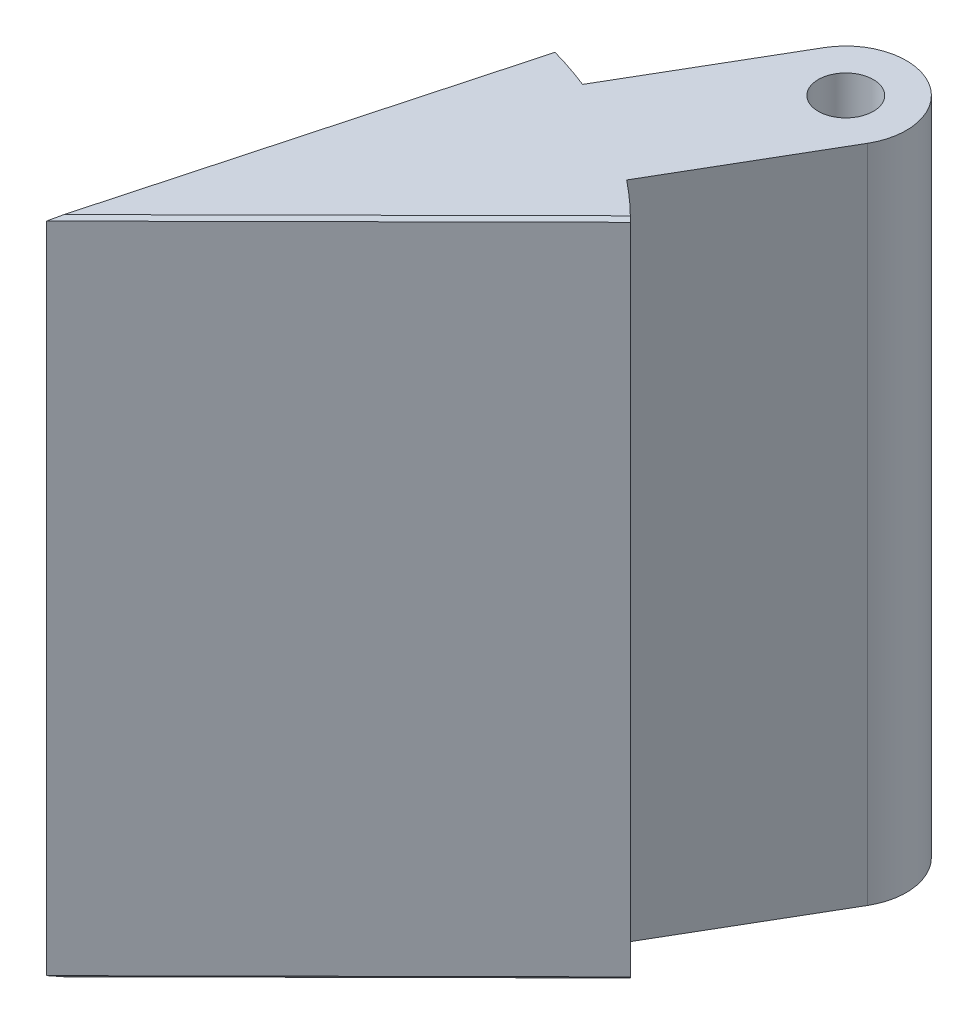
from build123d import *

# Parameters (mm, degrees)
SKETCH1_R           = 0.835
BOSS_EXTRUDE1_DEPTH = 20
CHAMFER1_SIZE       = 0.1


with BuildPart() as part:
    # Sketch1 → Boss-Extrude1 (new body)
    with BuildSketch(Plane(origin=(0, 0, 0), x_dir=(1, 0, 0), z_dir=(0, 1, 0))):
        with BuildLine():
            Line((2.776760362, 5.133225937), (0.142399779, 0.609778229))
            Line((0.142399779, 0.609778229), (0.0893221, 0.518638806))
            ThreePointArc((0.0893221, 0.518638806), (0.636251586, 0.056736494), (1.155841613, -0.435718389))
            Line((1.155841613, -0.435718389), (-7.720764547, -9.245763982))
            Line((-7.720764547, -9.245763982), (-4.441814223, 2.809787769))
            ThreePointArc((-4.441814223, 2.809787769), (-3.757359805, 2.60387674), (-3.085793629, 2.359180862))
            Line((-3.085793629, 2.359180862), (-3.030668296, 2.453836303))
            Line((-3.030668296, 2.453836303), (-0.394624771, 6.980173781))
            ThreePointArc((-0.394624771, 6.980173781), (2.114541718, 7.642392425), (2.776760362, 5.133225937))
        make_face()
        with Locations(Location((1.191067796, 6.056699859, 0), (0, 0, 270))):
            Circle(SKETCH1_R, mode=Mode.SUBTRACT)
    extrude(amount=BOSS_EXTRUDE1_DEPTH)

    # Chamfer1
    chamfer1_edges = [part.edges().sort_by_distance(p)[0] for p in [
        (-3.282461467, 20, 4.840741186),
        (-3.282461467, 0, 4.840741186),
        (-6.081289385, 20, 3.217988107),
        (-6.081289385, 0, 3.217988107),
    ]]
    chamfer(chamfer1_edges, length=CHAMFER1_SIZE)


solid = part.part
